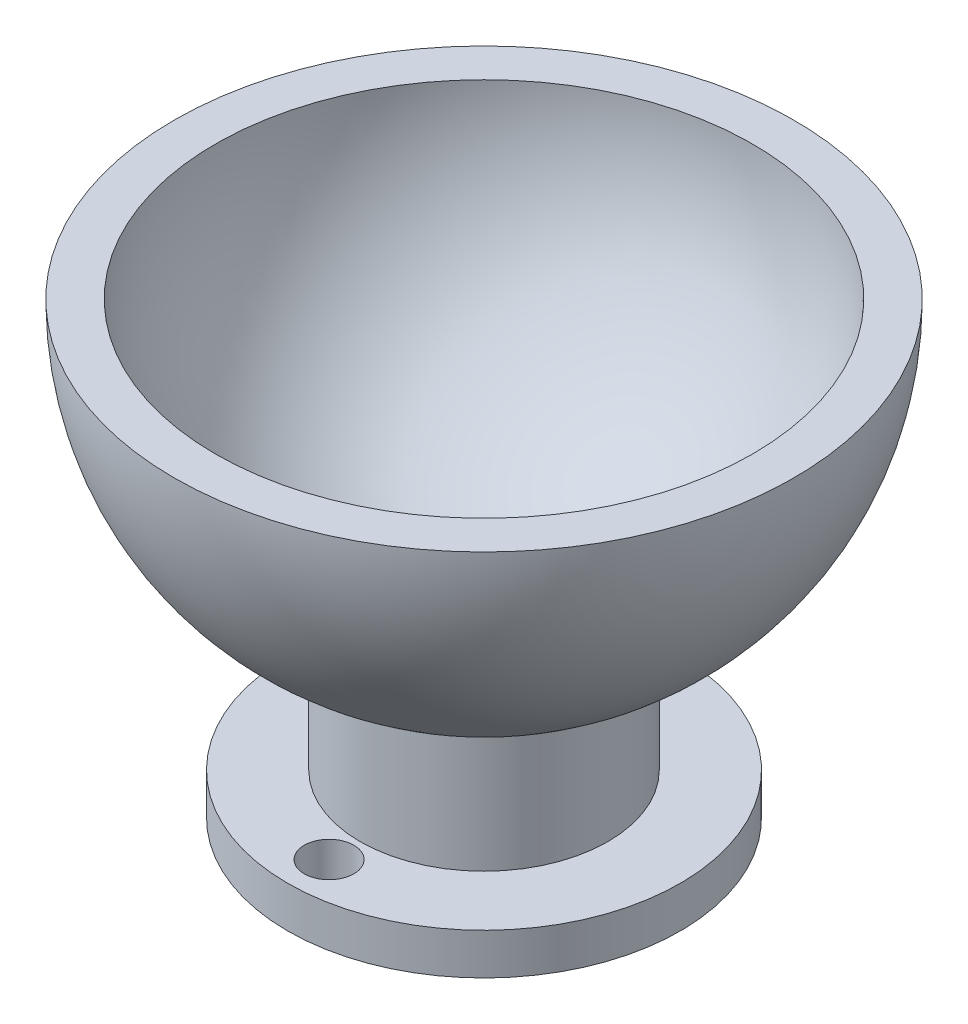
from build123d import *

# Parameters (mm, degrees)
SKETCH2_R           = 12.065
BOSS_EXTRUDE1_DEPTH = 2.54
SKETCH3_R           = 7.62
BOSS_EXTRUDE2_DEPTH = 7.62
SKETCH6_R           = 1.524
CUT_EXTRUDE1_DEPTH  = 5.08


with BuildPart() as part:
    # Sketch2 → Boss-Extrude1 (new body)
    with BuildSketch(Plane(origin=(0, 0, 0), x_dir=(1, 0, 0), z_dir=(0, 1, 0))):
        with Locations(Location((0, 0, 0), (0, 0, 270))):
            Circle(SKETCH2_R)
    extrude(amount=BOSS_EXTRUDE1_DEPTH)

    # Sketch3 → Boss-Extrude2 (add)
    with BuildSketch(Plane(origin=(0, 2.54, 0), x_dir=(1, 0, 0), z_dir=(0, 1, 0))):
        with Locations(Location((0, 0, 0), (0, 0, 90))):
            Circle(SKETCH3_R)
    extrude(amount=BOSS_EXTRUDE2_DEPTH)

    # Sketch6 → Cut-Extrude1 (cut)
    with BuildSketch(Plane.XZ):
        with Locations(Location((0, 9.525, 0), (0, 0, 270))):
            Circle(SKETCH6_R)
    extrude(amount=-CUT_EXTRUDE1_DEPTH, mode=Mode.SUBTRACT)


with BuildPart() as body_2:
    # Sketch5 → Revolve1 (revolve)
    with BuildSketch(Plane.XY):
        with BuildLine():
            Line((16.51, 27.619613398), (19.05, 27.619613398))
            ThreePointArc((19.05, 27.619613398), (13.470384182, 14.149229216), (0, 8.569613398))
            Line((0, 8.569613398), (0, 11.109613398))
            ThreePointArc((0, 11.109613398), (11.674332957, 15.94528044), (16.51, 27.619613398))
        make_face()
    revolve(axis=Axis((0, 47.87511184, 0), (0, -1, 0)))


solid = Compound([part.part, body_2.part])
